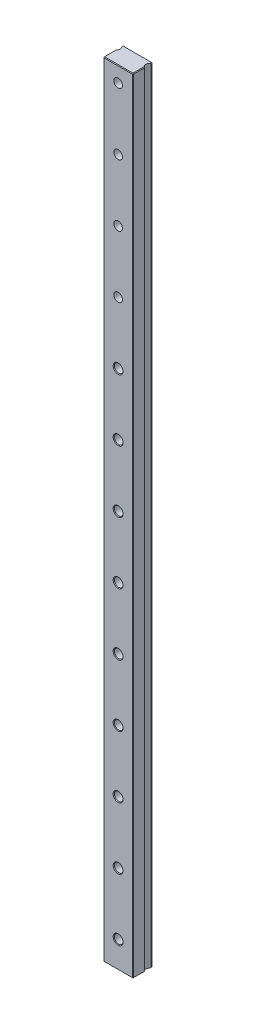
from build123d import *

# Parameters (mm, degrees)
BOSS_EXTRUDE1_DEPTH = 317
SKETCH3_R           = 1.75
CUT_EXTRUDE3_DEPTH  = 8.5
SKETCH3_6_R         = 3.25
SKETCH3_6_R_2       = 1.75
CUT_EXTRUDE4_DEPTH  = 4.5
CHAMFER3_SIZE       = 0.25


with BuildPart() as part:
    # Sketch1 → Boss-Extrude1 (new body)
    with BuildSketch(Plane(origin=(0, 0, 0), x_dir=(1, 0, 0), z_dir=(0, 1, 0))):
        with BuildLine():
            Line((6, 4), (-6, 4))
            Line((-6, 4), (-6, 3.299038106))
            ThreePointArc((-6, 3.299038106), (-5.25, 2), (-6, 0.700961894))
            Line((-6, 0.700961894), (-6, -4))
            Line((-6, -4), (6, -4))
            Line((6, -4), (6, 0.700961894))
            ThreePointArc((6, 0.700961894), (5.25, 2), (6, 3.299038106))
            Line((6, 3.299038106), (6, 4))
        make_face()
    extrude(amount=BOSS_EXTRUDE1_DEPTH)

    # Sketch3 → Cut-Extrude3 (cut)
    with BuildSketch(Plane(origin=(0, 0, -4), x_dir=(-1, 0, 0), z_dir=(0, 0, -1))):
        with Locations((0, 10.75)):
            Circle(SKETCH3_R)
        with Locations((0, 35.75)):
            Circle(SKETCH3_R)
        with Locations((0, 60.75)):
            Circle(SKETCH3_R)
        with Locations((0, 85.75)):
            Circle(SKETCH3_R)
        with Locations((0, 110.75)):
            Circle(SKETCH3_R)
        with Locations((0, 135.75)):
            Circle(SKETCH3_R)
        with Locations((0, 160.75)):
            Circle(SKETCH3_R)
        with Locations((0, 185.75)):
            Circle(SKETCH3_R)
        with Locations((0, 210.75)):
            Circle(SKETCH3_R)
        with Locations((0, 235.75)):
            Circle(SKETCH3_R)
        with Locations((0, 260.75)):
            Circle(SKETCH3_R)
        with Locations((0, 285.75)):
            Circle(SKETCH3_R)
        with Locations((0, 310.75)):
            Circle(SKETCH3_R)
        with Locations((0, 335.75)):
            Circle(SKETCH3_R)
    extrude(amount=-CUT_EXTRUDE3_DEPTH, mode=Mode.SUBTRACT)

    # Sketch3<6> → Cut-Extrude4 (cut)
    # profile 1 of 14: a face of its own
    with BuildSketch(Plane(origin=(0, 0, -4), x_dir=(-1, 0, 0), z_dir=(0, 0, -1))):
        with Locations((0, 10.75)):
            Circle(SKETCH3_6_R)
        with Locations((0, 10.75)):
            Circle(SKETCH3_6_R_2, mode=Mode.SUBTRACT)
    # profile 2 of 14: a face of its own
    with BuildSketch(Plane(origin=(0, 0, -4), x_dir=(-1, 0, 0), z_dir=(0, 0, -1))):
        with Locations((0, 35.75)):
            Circle(SKETCH3_6_R)
        with Locations((0, 35.75)):
            Circle(SKETCH3_6_R_2, mode=Mode.SUBTRACT)
    # profile 3 of 14: a face of its own
    with BuildSketch(Plane(origin=(0, 0, -4), x_dir=(-1, 0, 0), z_dir=(0, 0, -1))):
        with Locations((0, 60.75)):
            Circle(SKETCH3_6_R)
        with Locations((0, 60.75)):
            Circle(SKETCH3_6_R_2, mode=Mode.SUBTRACT)
    # profile 4 of 14: a face of its own
    with BuildSketch(Plane(origin=(0, 0, -4), x_dir=(-1, 0, 0), z_dir=(0, 0, -1))):
        with Locations((0, 85.75)):
            Circle(SKETCH3_6_R)
        with Locations((0, 85.75)):
            Circle(SKETCH3_6_R_2, mode=Mode.SUBTRACT)
    # profile 5 of 14: a face of its own
    with BuildSketch(Plane(origin=(0, 0, -4), x_dir=(-1, 0, 0), z_dir=(0, 0, -1))):
        with Locations((0, 110.75)):
            Circle(SKETCH3_6_R)
        with Locations((0, 110.75)):
            Circle(SKETCH3_6_R_2, mode=Mode.SUBTRACT)
    # profile 6 of 14: a face of its own
    with BuildSketch(Plane(origin=(0, 0, -4), x_dir=(-1, 0, 0), z_dir=(0, 0, -1))):
        with Locations((0, 135.75)):
            Circle(SKETCH3_6_R)
        with Locations((0, 135.75)):
            Circle(SKETCH3_6_R_2, mode=Mode.SUBTRACT)
    # profile 7 of 14: a face of its own
    with BuildSketch(Plane(origin=(0, 0, -4), x_dir=(-1, 0, 0), z_dir=(0, 0, -1))):
        with Locations((0, 160.75)):
            Circle(SKETCH3_6_R)
        with Locations((0, 160.75)):
            Circle(SKETCH3_6_R_2, mode=Mode.SUBTRACT)
    # profile 8 of 14: a face of its own
    with BuildSketch(Plane(origin=(0, 0, -4), x_dir=(-1, 0, 0), z_dir=(0, 0, -1))):
        with Locations((0, 185.75)):
            Circle(SKETCH3_6_R)
        with Locations((0, 185.75)):
            Circle(SKETCH3_6_R_2, mode=Mode.SUBTRACT)
    # profile 9 of 14: a face of its own
    with BuildSketch(Plane(origin=(0, 0, -4), x_dir=(-1, 0, 0), z_dir=(0, 0, -1))):
        with Locations((0, 210.75)):
            Circle(SKETCH3_6_R)
        with Locations((0, 210.75)):
            Circle(SKETCH3_6_R_2, mode=Mode.SUBTRACT)
    # profile 10 of 14: a face of its own
    with BuildSketch(Plane(origin=(0, 0, -4), x_dir=(-1, 0, 0), z_dir=(0, 0, -1))):
        with Locations((0, 235.75)):
            Circle(SKETCH3_6_R)
        with Locations((0, 235.75)):
            Circle(SKETCH3_6_R_2, mode=Mode.SUBTRACT)
    # profile 11 of 14: a face of its own
    with BuildSketch(Plane(origin=(0, 0, -4), x_dir=(-1, 0, 0), z_dir=(0, 0, -1))):
        with Locations((0, 260.75)):
            Circle(SKETCH3_6_R)
        with Locations((0, 260.75)):
            Circle(SKETCH3_6_R_2, mode=Mode.SUBTRACT)
    # profile 12 of 14: a face of its own
    with BuildSketch(Plane(origin=(0, 0, -4), x_dir=(-1, 0, 0), z_dir=(0, 0, -1))):
        with Locations((0, 285.75)):
            Circle(SKETCH3_6_R)
        with Locations((0, 285.75)):
            Circle(SKETCH3_6_R_2, mode=Mode.SUBTRACT)
    # profile 13 of 14: a face of its own
    with BuildSketch(Plane(origin=(0, 0, -4), x_dir=(-1, 0, 0), z_dir=(0, 0, -1))):
        with Locations((0, 310.75)):
            Circle(SKETCH3_6_R)
        with Locations((0, 310.75)):
            Circle(SKETCH3_6_R_2, mode=Mode.SUBTRACT)
    # profile 14 of 14: a face of its own
    with BuildSketch(Plane(origin=(0, 0, -4), x_dir=(-1, 0, 0), z_dir=(0, 0, -1))):
        with Locations((0, 335.75)):
            Circle(SKETCH3_6_R)
        with Locations((0, 335.75)):
            Circle(SKETCH3_6_R_2, mode=Mode.SUBTRACT)
    extrude(amount=-CUT_EXTRUDE4_DEPTH, mode=Mode.SUBTRACT)

    # Chamfer3
    chamfer3_edges = [part.edges().sort_by_distance(p)[0] for p in [
        (1.75, 210.75, 4),
        (1.75, 185.75, 4),
        (1.75, 160.75, 4),
        (1.75, 135.75, 4),
        (1.75, 110.75, 4),
        (1.75, 85.75, 4),
        (1.75, 60.75, 4),
        (1.75, 35.75, 4),
        (1.75, 10.75, 4),
        (0, 0, 4),
        (6, 0, 1.649519053),
        (-6, 0, 1.649519053),
        (6, 317, 1.649519053),
        (-6, 317, 1.649519053),
        (6, 158.5, 4),
        (0, 317, 4),
        (-6, 158.5, 4),
        (6, 0, -3.649519053),
        (-6, 0, -3.649519053),
        (0, 0, -4),
        (6, 317, -3.649519053),
        (-6, 317, -3.649519053),
        (-6, 158.5, -4),
        (0, 317, -4),
        (6, 158.5, -4),
        (3.25, 210.75, -4),
        (1.75, 210.75, 0.5),
        (3.25, 185.75, -4),
        (1.75, 185.75, 0.5),
        (3.25, 160.75, -4),
        (1.75, 160.75, 0.5),
        (3.25, 135.75, -4),
        (1.75, 135.75, 0.5),
        (3.25, 110.75, -4),
        (1.75, 110.75, 0.5),
        (3.25, 85.75, -4),
        (1.75, 85.75, 0.5),
        (3.25, 60.75, -4),
        (1.75, 60.75, 0.5),
        (3.25, 35.75, -4),
        (1.75, 35.75, 0.5),
        (3.25, 10.75, -4),
        (1.75, 10.75, 0.5),
    ]]
    chamfer(chamfer3_edges, length=CHAMFER3_SIZE)


solid = part.part
